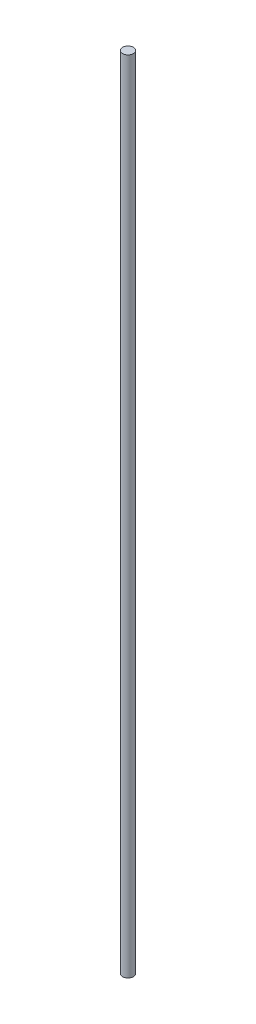
from build123d import *

# Parameters (mm, degrees)
SKETCH1_R           = 4.1
BOSS_EXTRUDE1_DEPTH = 600


with BuildPart() as part:
    # Sketch1 → Boss-Extrude1 (new body)
    with BuildSketch(Plane(origin=(0, 0, 0), x_dir=(1, 0, 0), z_dir=(0, 1, 0))):
        with Locations(Location((0, 0, 0), (0, 0, 270))):
            Circle(SKETCH1_R)
    extrude(amount=BOSS_EXTRUDE1_DEPTH)


solid = part.part
